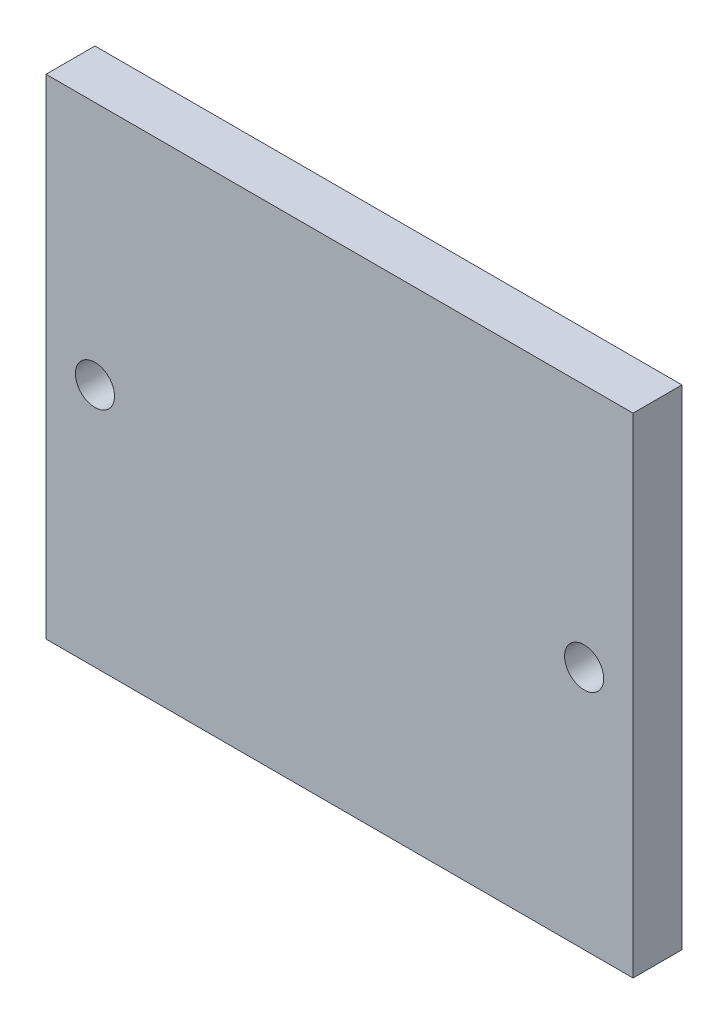
from build123d import *

# Parameters (mm, degrees)
ESQUISSE1_W        = 60
ESQUISSE1_H        = 50
ESQUISSE1_R        = 2
BOSS_EXTRU_1_DEPTH = 5


with BuildPart() as part:
    # Esquisse1 → Boss.-Extru.1 (new body)
    with BuildSketch(Plane.XY):
        Rectangle(ESQUISSE1_W, ESQUISSE1_H)
        with Locations((25, 0)):
            Circle(ESQUISSE1_R, mode=Mode.SUBTRACT)
        with Locations(Location((-25, 0, 0), (0, 0, 180))):
            Circle(ESQUISSE1_R, mode=Mode.SUBTRACT)
    extrude(amount=BOSS_EXTRU_1_DEPTH)


solid = part.part
